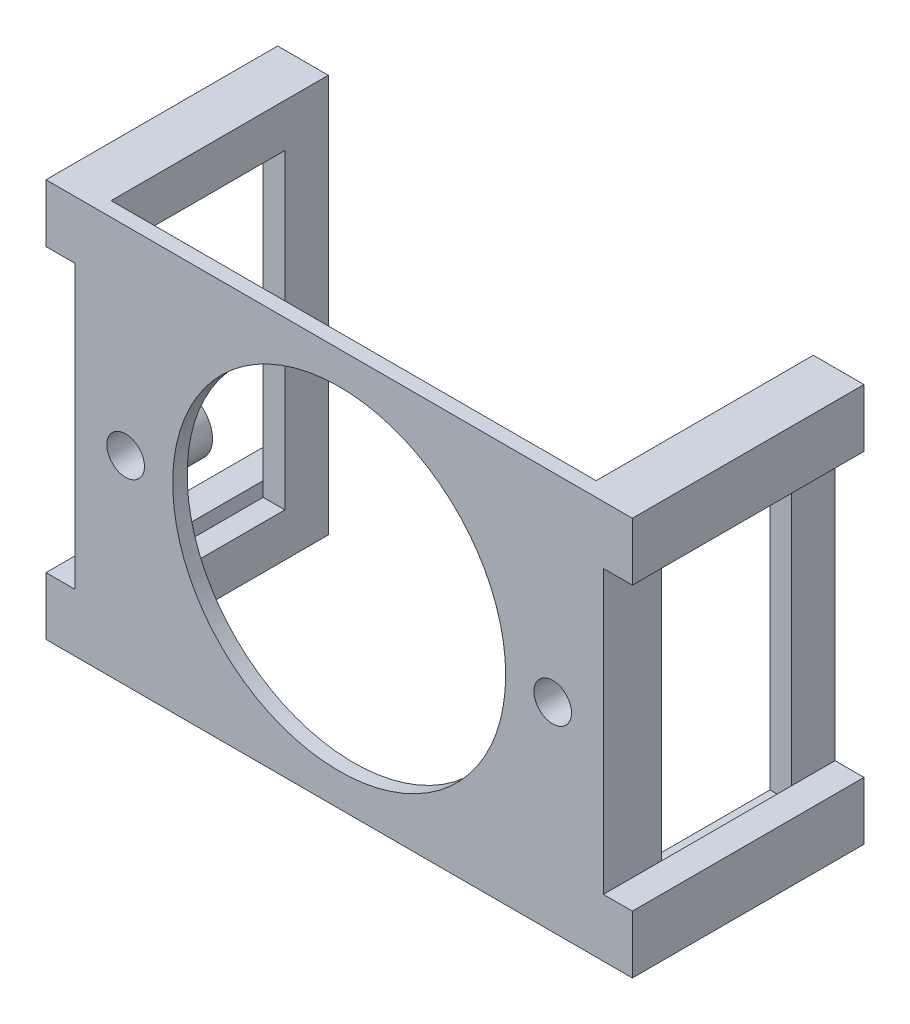
from build123d import *

# Parameters (mm, degrees)
SKETCH2_W           = 36.5
SKETCH2_H           = 27.5
SKETCH2_R           = 11.5
SKETCH2_R_2         = 1.3
BOSS_EXTRUDE1_DEPTH = 1
SKETCH4_R           = 1.3
BOSS_EXTRUDE2_DEPTH = 3
SKETCH5_W           = 1.5
SKETCH5_H           = 27.5
BOSS_EXTRUDE3_DEPTH = 12
SKETCH6_W           = 9
SKETCH6_H           = 21.5
CUT_EXTRUDE1_DEPTH  = 1.5
BOSS_EXTRUDE4_REACH = 29.895
SKETCH7_W           = 2
SKETCH7_H           = 4


with BuildPart() as part:
    # Sketch2 → Boss-Extrude1 (new body)
    with BuildSketch(Plane.XY):
        Rectangle(SKETCH2_W, SKETCH2_H)
        Circle(SKETCH2_R, mode=Mode.SUBTRACT)
        with Locations((-14.75, 0)):
            Circle(SKETCH2_R_2, mode=Mode.SUBTRACT)
        with Locations((14.75, 0)):
            Circle(SKETCH2_R_2, mode=Mode.SUBTRACT)
    extrude(amount=-BOSS_EXTRUDE1_DEPTH)

    # Sketch4 → Boss-Extrude2 (add)
    with BuildSketch(Plane(origin=(0, 0, -1), x_dir=(-1, 0, 0), z_dir=(0, 0, -1))):
        with BuildLine():
            Line((-16.75, 4), (-16.75, 13.75))
            Line((-16.75, 13.75), (-18.25, 13.75))
            Line((-18.25, 13.75), (-18.25, -13.75))
            Line((-18.25, -13.75), (-16.75, -13.75))
            Line((-16.75, -13.75), (-16.75, -4))
            ThreePointArc((-16.75, -4), (-16.164213562, -2.585786438), (-14.75, -2))
            ThreePointArc((-14.75, -2), (-12.75, 0), (-14.75, 2))
            ThreePointArc((-14.75, 2), (-16.164213562, 2.585786438), (-16.75, 4))
        make_face()
        with Locations((-14.75, 0)):
            Circle(SKETCH4_R, mode=Mode.SUBTRACT)
    boss_extrude2 = extrude(amount=BOSS_EXTRUDE2_DEPTH)

    # Sketch5 → Boss-Extrude3 (add)
    with BuildSketch(Plane(origin=(0, 0, -4), x_dir=(-1, 0, 0), z_dir=(0, 0, -1))):
        with Locations((-17.5, 0)):
            Rectangle(SKETCH5_W, SKETCH5_H)
    boss_extrude3 = extrude(amount=BOSS_EXTRUDE3_DEPTH)

    # Sketch6 → Cut-Extrude1 (cut)
    with BuildSketch(Plane(origin=(18.25, 0, 0), x_dir=(0, 0, -1), z_dir=(1, 0, 0))):
        with Locations((8.5, 0)):
            Rectangle(SKETCH6_W, SKETCH6_H)
    cut_extrude1 = extrude(amount=-CUT_EXTRUDE1_DEPTH, mode=Mode.SUBTRACT)

    # Boss-Extrude4: up to this face of the body (flat: up to its plane)
    boss_extrude4_end = Plane(part.part.faces().sort_by_distance((-17.792998906, 0, 0))[0])
    # Sketch7 → Boss-Extrude4 (add, up to the picked face)
    with BuildSketch(Plane(origin=(0, 0, -16), x_dir=(-1, 0, 0), z_dir=(0, 0, -1)), mode=Mode.PRIVATE) as boss_extrude4_sk1:
        with Locations((-19.25, 11.75)):
            Rectangle(SKETCH7_W, SKETCH7_H)
    boss_extrude4_tool1 = split(extrude(boss_extrude4_sk1.sketch, amount=-BOSS_EXTRUDE4_REACH, mode=Mode.PRIVATE), bisect_by=boss_extrude4_end, keep=Keep.BOTH, mode=Mode.PRIVATE)
    # Sketch7 → Boss-Extrude4 (add, up to the picked face)
    with BuildSketch(Plane(origin=(0, 0, -16), x_dir=(-1, 0, 0), z_dir=(0, 0, -1)), mode=Mode.PRIVATE) as boss_extrude4_sk2:
        with Locations((-19.25, -11.75)):
            Rectangle(SKETCH7_W, SKETCH7_H)
    boss_extrude4_tool2 = split(extrude(boss_extrude4_sk2.sketch, amount=-BOSS_EXTRUDE4_REACH, mode=Mode.PRIVATE), bisect_by=boss_extrude4_end, keep=Keep.BOTH, mode=Mode.PRIVATE)
    boss_extrude4_1 = boss_extrude4_tool1.solids().sort_by(Axis((19.25, 11.75, -16), (0, 0, 1)))[0]
    add(boss_extrude4_1)
    boss_extrude4_2 = boss_extrude4_tool2.solids().sort_by(Axis((19.25, -11.75, -16), (0, 0, 1)))[0]
    add(boss_extrude4_2)
    boss_extrude4 = boss_extrude4_1 + boss_extrude4_2  # Boss-Extrude4 as one shape, for the pattern or mirror that repeats it

    # Mirror1: Boss-Extrude2, Boss-Extrude3, Cut-Extrude1, Boss-Extrude4 across plane
    add(boss_extrude2.mirror(Plane(origin=(0, 0, 0), x_dir=(0, 0, 1), z_dir=(1, 0, 0))))
    add(boss_extrude3.mirror(Plane(origin=(0, 0, 0), x_dir=(0, 0, 1), z_dir=(1, 0, 0))))
    add(cut_extrude1.mirror(Plane(origin=(0, 0, 0), x_dir=(0, 0, 1), z_dir=(1, 0, 0))), mode=Mode.SUBTRACT)
    add(boss_extrude4.mirror(Plane(origin=(0, 0, 0), x_dir=(0, 0, 1), z_dir=(1, 0, 0))))


solid = part.part
